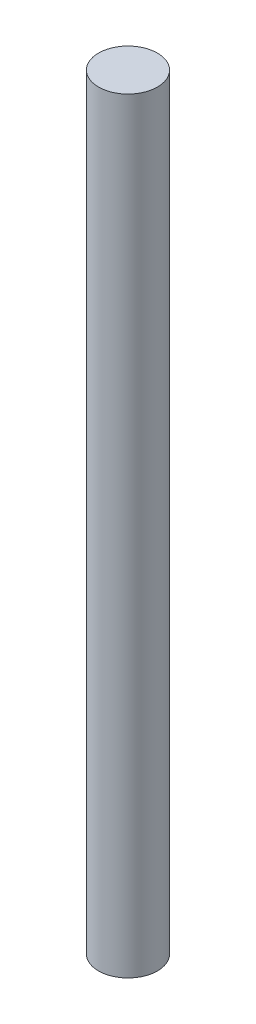
from build123d import *

# Parameters (mm, degrees)
SKETCH1_R           = 3.175
BOSS_EXTRUDE1_DEPTH = 82.55


with BuildPart() as part:
    # Sketch1 → Boss-Extrude1 (new body)
    with BuildSketch(Plane(origin=(0, 0, 0), x_dir=(1, 0, 0), z_dir=(0, 1, 0))):
        with Locations(Location((0, 0, 0), (0, 0, 270))):
            Circle(SKETCH1_R)
    extrude(amount=BOSS_EXTRUDE1_DEPTH)


solid = part.part
